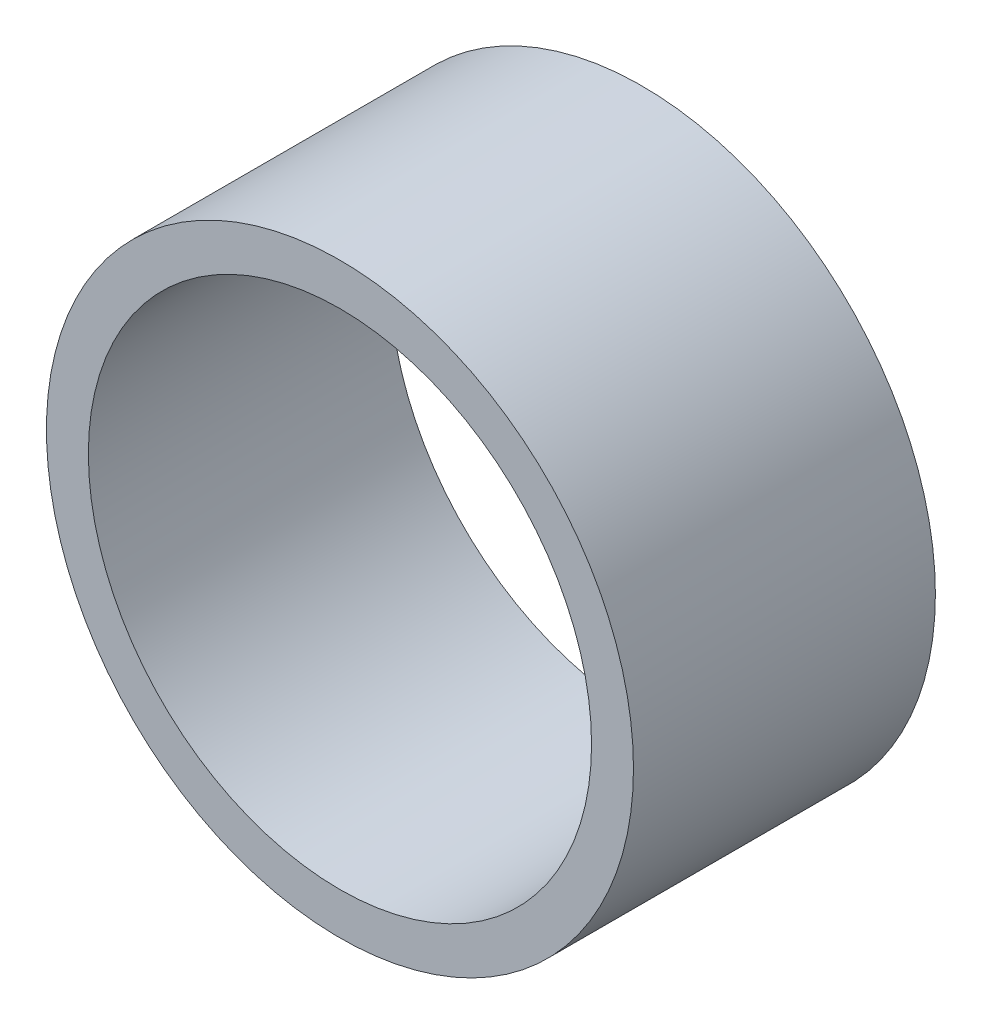
from build123d import *

# Parameters (mm, degrees)
SKETCH1_R           = 52.5
SKETCH1_R_2         = 45
BOSS_EXTRUDE1_DEPTH = 27


with BuildPart() as part:
    # Sketch1 → Boss-Extrude1 (new, symmetric)
    with BuildSketch(Plane.XY):
        Circle(SKETCH1_R)
        Circle(SKETCH1_R_2, mode=Mode.SUBTRACT)
    extrude(amount=BOSS_EXTRUDE1_DEPTH, both=True)


solid = part.part
